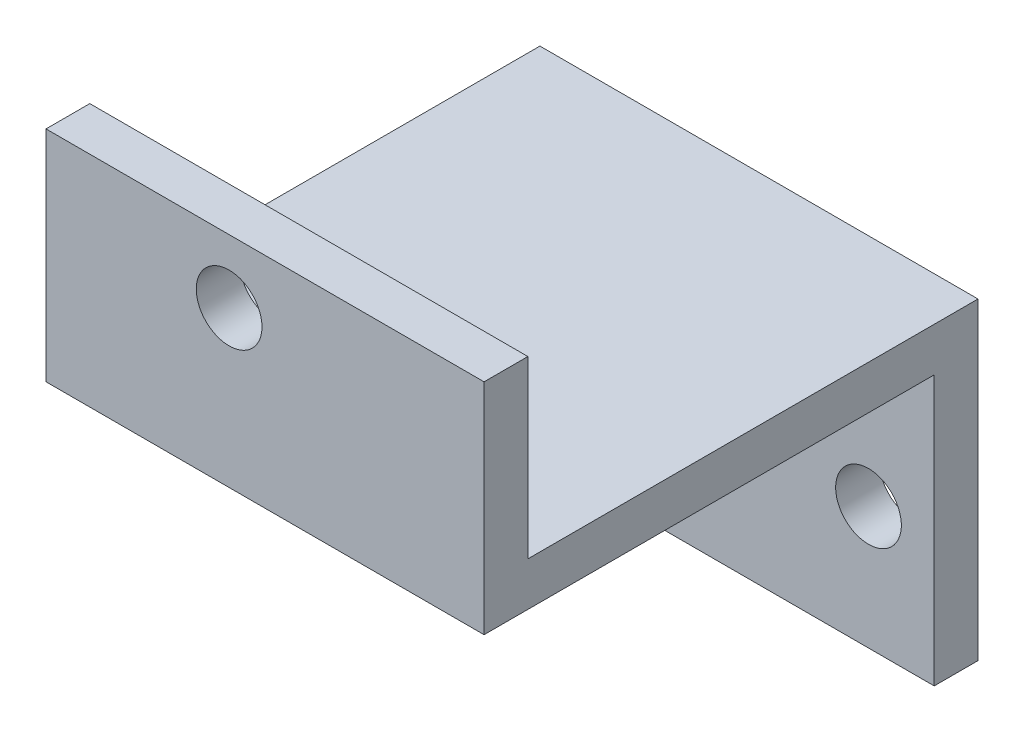
from build123d import *

# Parameters (mm, degrees)
ESQUISSE1_W             = 20
ESQUISSE1_H             = 14.3
BOSS_EXTRU_1_DEPTH      = 2
ESQUISSE2_W             = 20
ESQUISSE2_H             = 2
BOSS_EXTRU_2_DEPTH      = 20.55
ESQUISSE3_W             = 20
ESQUISSE3_H             = 2
BOSS_EXTRU_3_DEPTH      = 8
ESQUISSE4_R             = 1.5
ENL_V_MAT_EXTRU_2_DEPTH = 8
ESQUISSE5_R             = 1.5
ENL_V_MAT_EXTRU_3_DEPTH = 8


with BuildPart() as part:
    # Esquisse1 → Boss.-Extru.1 (new body)
    with BuildSketch(Plane.XY):
        with Locations((10, 7.15)):
            Rectangle(ESQUISSE1_W, ESQUISSE1_H)
    extrude(amount=BOSS_EXTRU_1_DEPTH)

    # Esquisse2 → Boss.-Extru.2 (add)
    with BuildSketch(Plane.XY.offset(2)):
        with Locations((10, 13.3)):
            Rectangle(ESQUISSE2_W, ESQUISSE2_H)
    extrude(amount=BOSS_EXTRU_2_DEPTH)

    # Esquisse3 → Boss.-Extru.3 (add)
    with BuildSketch(Plane(origin=(0, 14.3, 0), x_dir=(1, 0, 0), z_dir=(0, 1, 0))):
        with Locations((10, -21.55)):
            Rectangle(ESQUISSE3_W, ESQUISSE3_H)
    extrude(amount=BOSS_EXTRU_3_DEPTH)

    # Esquisse4 → Enlèv. mat.-Extru.2 (cut)
    with BuildSketch(Plane(origin=(0, 0, 0), x_dir=(-1, 0, 0), z_dir=(0, 0, -1))):
        with Locations((-17, 5.6)):
            Circle(ESQUISSE4_R)
        with Locations((-3, 5.6)):
            Circle(ESQUISSE4_R)
    extrude(amount=-ENL_V_MAT_EXTRU_2_DEPTH, mode=Mode.SUBTRACT)

    # Esquisse5 → Enlèv. mat.-Extru.3 (cut)
    with BuildSketch(Plane.XY.offset(22.55)):
        with Locations((8.36, 19.4)):
            Circle(ESQUISSE5_R)
    extrude(amount=-ENL_V_MAT_EXTRU_3_DEPTH, mode=Mode.SUBTRACT)


solid = part.part
